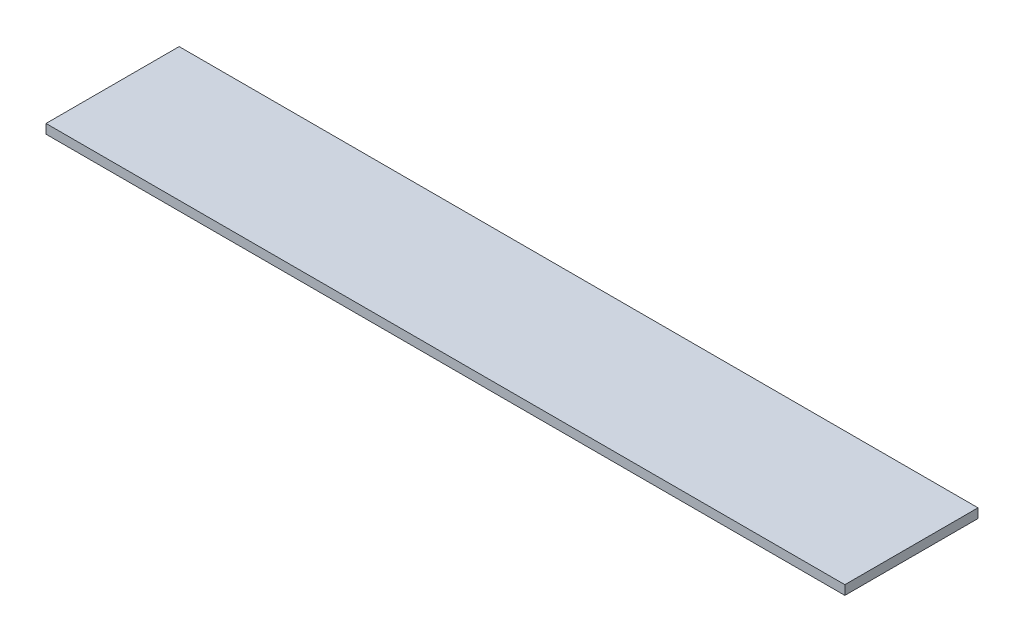
from build123d import *

# Parameters (mm, degrees)
SKETCH1_W           = 60
SKETCH1_H           = 10
BOSS_EXTRUDE1_DEPTH = 0.7


with BuildPart() as part:
    # Sketch1 → Boss-Extrude1 (new body)
    with BuildSketch(Plane(origin=(0, 0, 0), x_dir=(1, 0, 0), z_dir=(0, 1, 0))):
        Rectangle(SKETCH1_W, SKETCH1_H)
    extrude(amount=BOSS_EXTRUDE1_DEPTH)


solid = part.part
